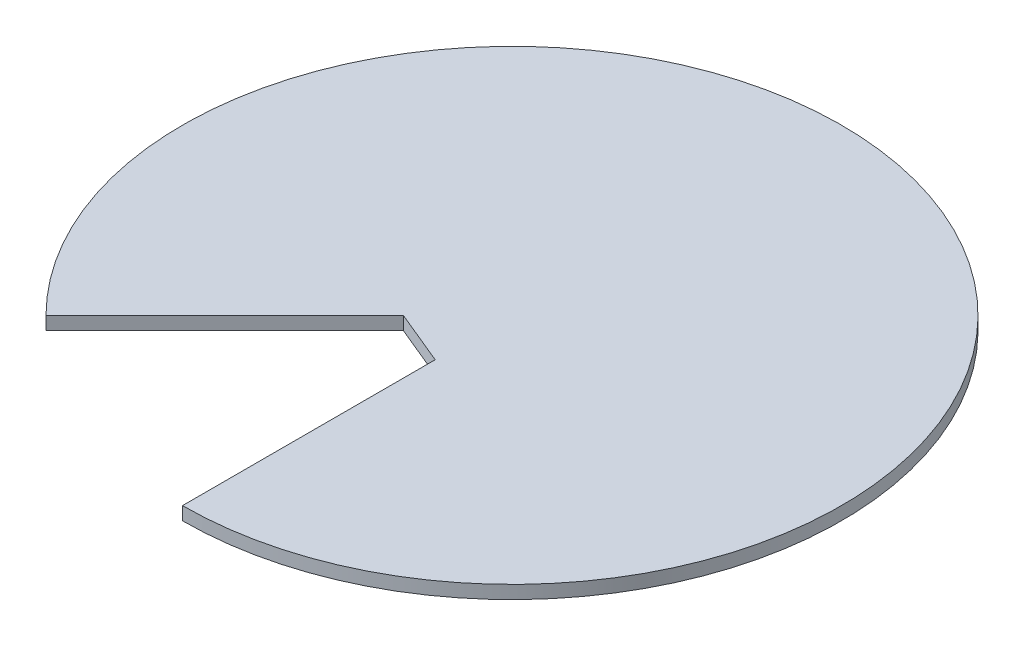
from build123d import *

# Parameters (mm, degrees)
SKETCH1_R           = 75
BOSS_EXTRUDE1_DEPTH = 3
CUT_EXTRUDE1_START  = -3
CUT_EXTRUDE1_DEPTH  = 3


with BuildPart() as part:
    # Sketch1 → Boss-Extrude1 (new body)
    with BuildSketch(Plane(origin=(0, 0, 0), x_dir=(1, 0, 0), z_dir=(0, 1, 0))):
        with Locations(Location((0, 0, 0), (0, 0, 270))):
            Circle(SKETCH1_R)
    extrude(amount=BOSS_EXTRUDE1_DEPTH)

    # Sketch2 → Cut-Extrude1 (cut)
    with BuildSketch(Plane(origin=(0, 3, 0), x_dir=(1, 0, 0), z_dir=(0, 1, 0)).offset(CUT_EXTRUDE1_START)):
        with BuildLine():
            Line((-53.033008589, -53.033008589), (-12.366320483, -12.366320483))
            Line((-12.366320483, -12.366320483), (0, -17.488618143))
            Line((0, -17.488618143), (0, -75))
            ThreePointArc((0, -75), (-28.701257427, -69.290964938), (-53.033008589, -53.033008589))
        make_face()
    extrude(amount=CUT_EXTRUDE1_DEPTH, mode=Mode.SUBTRACT)


solid = part.part
